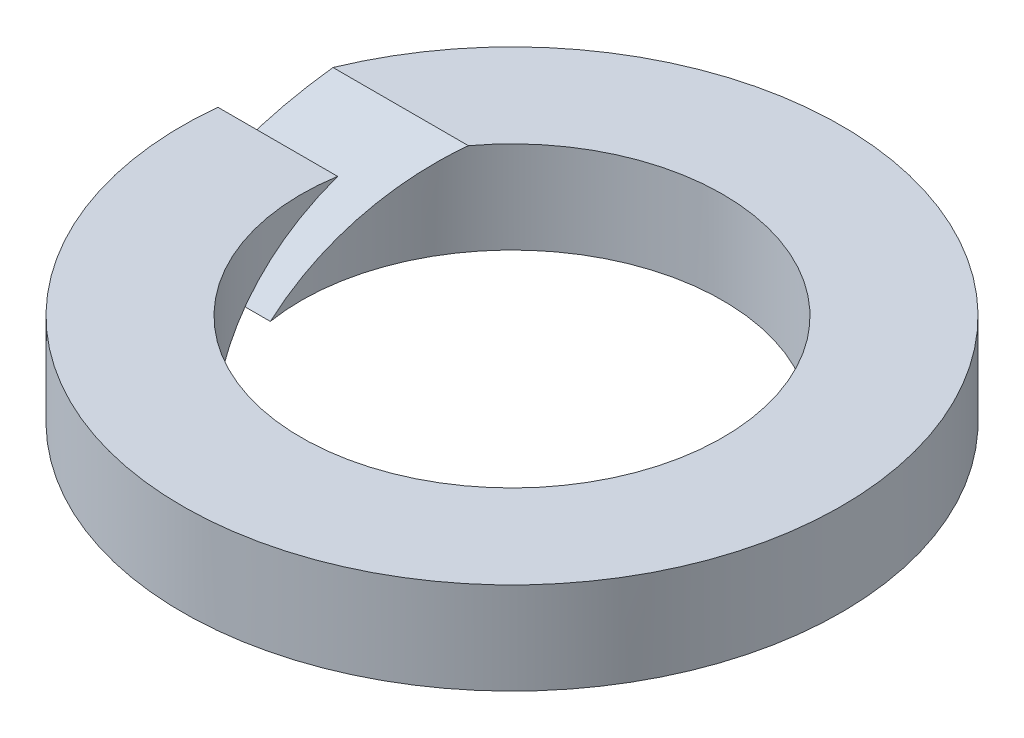
from build123d import *

# Parameters (mm, degrees)
SKETCH1_R      = 21.5
SKETCH1_R_2    = 13.75
EXTRUDE1_DEPTH = 6
EXTRUDE2_DEPTH = 31.991934435


with BuildPart() as part:
    # Sketch1 → Extrude1 (new body)
    with BuildSketch(Plane(origin=(0, 0, 0), x_dir=(1, 0, 0), z_dir=(0, 1, 0))):
        with Locations(Location((0, 0, 0), (0, 0, 270))):
            Circle(SKETCH1_R)
        with Locations(Location((0, 0, 0), (0, 0, 270))):
            Circle(SKETCH1_R_2, mode=Mode.SUBTRACT)
    extrude(amount=EXTRUDE1_DEPTH)

    # Sketch2 → Extrude2 (cut, through all)
    with BuildSketch(Plane(origin=(0, 0, 0), x_dir=(0, 0, -1), z_dir=(1, 0, 0))):
        Polygon((-8.196152423, 0), (-2.196152423, 0), (8.196152423, 6), (2.196152423, 6), align=None)
    extrude(amount=-EXTRUDE2_DEPTH, mode=Mode.SUBTRACT)


solid = part.part
